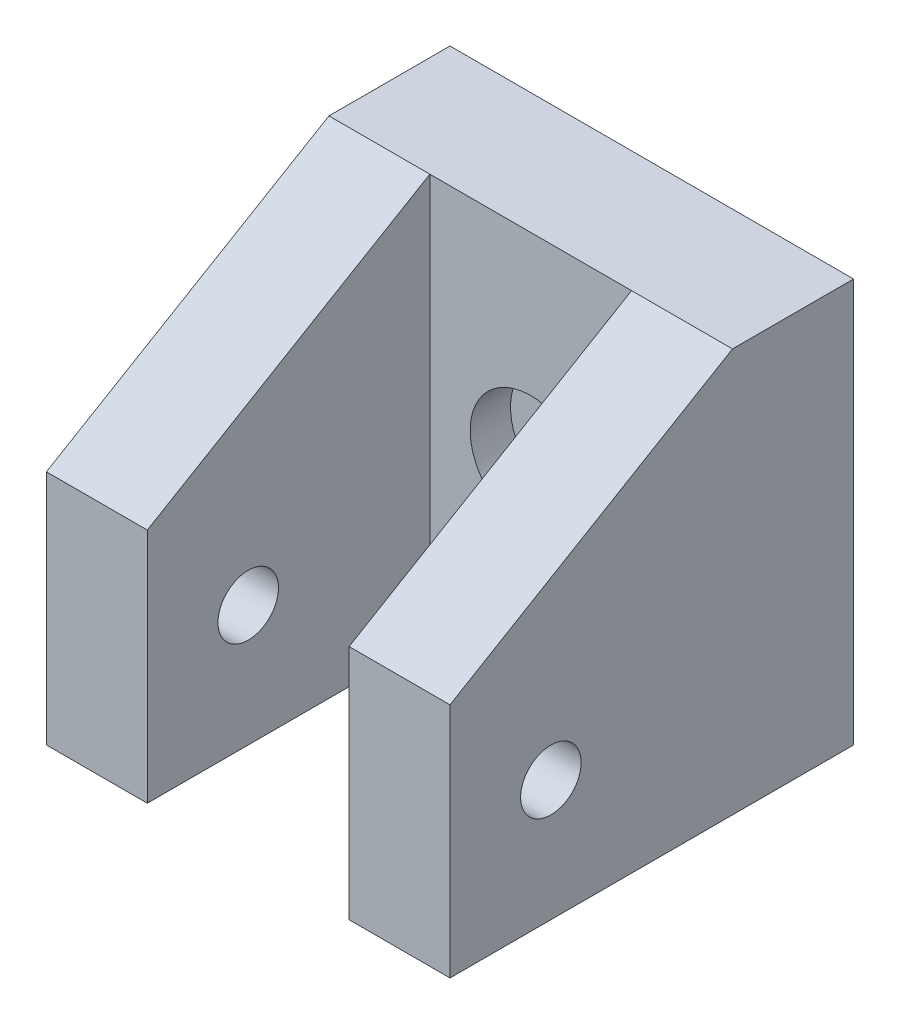
from build123d import *

# Parameters (mm, degrees)
SKETCH_1_W          = 20
SKETCH_1_H          = 20
EXTRUDE_1_DEPTH     = 20
SKETCH_2_W          = 10
SKETCH_2_H          = 20
CUT_EXTRUDE_1_DEPTH = 14
SKETCH_3_R          = 1.6
CUT_EXTRUDE_2_DEPTH = 32.559467676
SKETCH_5_R          = 3
CUT_EXTRUDE_3_DEPTH = 2
SKETCH_6_R          = 1.5
CUT_EXTRUDE_4_DEPTH = 35.641016151


with BuildPart() as part:
    # 草图1 → 凸台-拉伸1 (new body)
    with BuildSketch(Plane.XY):
        with Locations((10, 10)):
            Rectangle(SKETCH_1_W, SKETCH_1_H)
    extrude(amount=EXTRUDE_1_DEPTH)

    # 草图2 → 切除-拉伸1 (cut)
    with BuildSketch(Plane.XY.offset(20)):
        with Locations((10, 10)):
            Rectangle(SKETCH_2_W, SKETCH_2_H)
    extrude(amount=-CUT_EXTRUDE_1_DEPTH, mode=Mode.SUBTRACT)

    # 草图3 → 切除-拉伸2 (cut, through all)
    with BuildSketch(Plane.XY.offset(6)):
        with Locations((10, 10)):
            Circle(SKETCH_3_R)
    extrude(amount=-CUT_EXTRUDE_2_DEPTH, mode=Mode.SUBTRACT)

    # 草图5 → 切除-拉伸3 (cut)
    with BuildSketch(Plane.XY.offset(6)):
        with Locations((10, 10)):
            Circle(SKETCH_5_R)
    extrude(amount=-CUT_EXTRUDE_3_DEPTH, mode=Mode.SUBTRACT)

    # 草图6 → 切除-拉伸4 (cut, through all)
    with BuildSketch(Plane(origin=(20, 0, 0), x_dir=(0, 0, -1), z_dir=(1, 0, 0))):
        with Locations((-15, 6)):
            Circle(SKETCH_6_R)
        Polygon((-20, 20), (-6, 20), (-20, 11.725834551), align=None)
    extrude(amount=-CUT_EXTRUDE_4_DEPTH, mode=Mode.SUBTRACT)


solid = part.part
